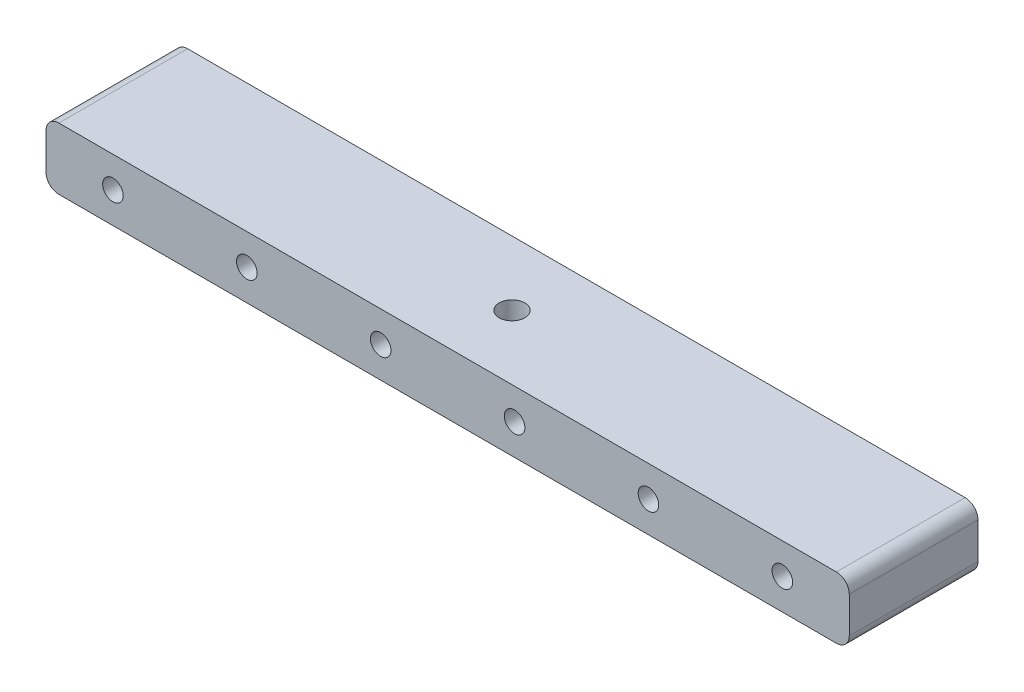
from build123d import *

# Parameters (mm, degrees)
SKETCH1_W               = 156
SKETCH1_H               = 25
SKETCH1_R               = 2.5
BOSS_EXTRUDE1_DEPTH     = 6
FILLET1_R               = 2.5
SKETCH2_R               = 2
CUT_EXTRUDE1_DEPTH      = 10
LPATTERN1_COUNT         = 6
LPATTERN1_PITCH         = 26
MIRROR1_COPY_1_SKETCH_R = 2
MIRROR1_COPY_1_DEPTH    = 10
MIRROR1_COPY_2_SKETCH_R = 2
MIRROR1_COPY_2_DEPTH    = 10
MIRROR1_COPY_3_SKETCH_R = 2
MIRROR1_COPY_3_DEPTH    = 10
MIRROR1_COPY_4_SKETCH_R = 2
MIRROR1_COPY_4_DEPTH    = 10
MIRROR1_COPY_5_SKETCH_R = 2
MIRROR1_COPY_5_DEPTH    = 10


with BuildPart() as part:
    # Sketch1 → Boss-Extrude1 (new, symmetric)
    with BuildSketch(Plane(origin=(0, 0, 0), x_dir=(1, 0, 0), z_dir=(0, 1, 0))):
        Rectangle(SKETCH1_W, SKETCH1_H)
        with Locations(Location((0, 0, 0), (0, 0, 270))):
            Circle(SKETCH1_R, mode=Mode.SUBTRACT)
    extrude(amount=BOSS_EXTRUDE1_DEPTH, both=True)

    # Fillet1
    fillet1_edges = [part.edges().sort_by_distance(p)[0] for p in [
        (-78, 6, 0),
        (78, 6, 0),
        (-78, -6, 0),
        (78, -6, 0),
    ]]
    fillet(fillet1_edges, radius=FILLET1_R)

    # Sketch2 → Cut-Extrude1 (cut)
    with BuildSketch(Plane.XY.offset(12.5)):
        with Locations((-65, 0)):
            Circle(SKETCH2_R)
    cut_extrude1 = extrude(amount=-CUT_EXTRUDE1_DEPTH, mode=Mode.SUBTRACT)

    # LPattern1: Cut-Extrude1 ×6
    with Locations(*[(i * LPATTERN1_PITCH, 0, 0) for i in range(1, LPATTERN1_COUNT)]):
        add(cut_extrude1, mode=Mode.SUBTRACT)

    # Mirror1: Cut-Extrude1 across plane
    add(cut_extrude1.mirror(Plane.XY), mode=Mode.SUBTRACT)

    # Mirror1 copy 1 sketch → Mirror1 copy 1 (cut)
    with BuildSketch(Plane(origin=(26, 0, -12.5), x_dir=(1, 0, 0), z_dir=(0, 0, -1))):
        with Locations((-65, 0)):
            Circle(MIRROR1_COPY_1_SKETCH_R)
    extrude(amount=-MIRROR1_COPY_1_DEPTH, mode=Mode.SUBTRACT)

    # Mirror1 copy 2 sketch → Mirror1 copy 2 (cut)
    with BuildSketch(Plane(origin=(52, 0, -12.5), x_dir=(1, 0, 0), z_dir=(0, 0, -1))):
        with Locations((-65, 0)):
            Circle(MIRROR1_COPY_2_SKETCH_R)
    extrude(amount=-MIRROR1_COPY_2_DEPTH, mode=Mode.SUBTRACT)

    # Mirror1 copy 3 sketch → Mirror1 copy 3 (cut)
    with BuildSketch(Plane(origin=(78, 0, -12.5), x_dir=(1, 0, 0), z_dir=(0, 0, -1))):
        with Locations((-65, 0)):
            Circle(MIRROR1_COPY_3_SKETCH_R)
    extrude(amount=-MIRROR1_COPY_3_DEPTH, mode=Mode.SUBTRACT)

    # Mirror1 copy 4 sketch → Mirror1 copy 4 (cut)
    with BuildSketch(Plane(origin=(104, 0, -12.5), x_dir=(1, 0, 0), z_dir=(0, 0, -1))):
        with Locations((-65, 0)):
            Circle(MIRROR1_COPY_4_SKETCH_R)
    extrude(amount=-MIRROR1_COPY_4_DEPTH, mode=Mode.SUBTRACT)

    # Mirror1 copy 5 sketch → Mirror1 copy 5 (cut)
    with BuildSketch(Plane(origin=(130, 0, -12.5), x_dir=(1, 0, 0), z_dir=(0, 0, -1))):
        with Locations((-65, 0)):
            Circle(MIRROR1_COPY_5_SKETCH_R)
    extrude(amount=-MIRROR1_COPY_5_DEPTH, mode=Mode.SUBTRACT)


solid = part.part
